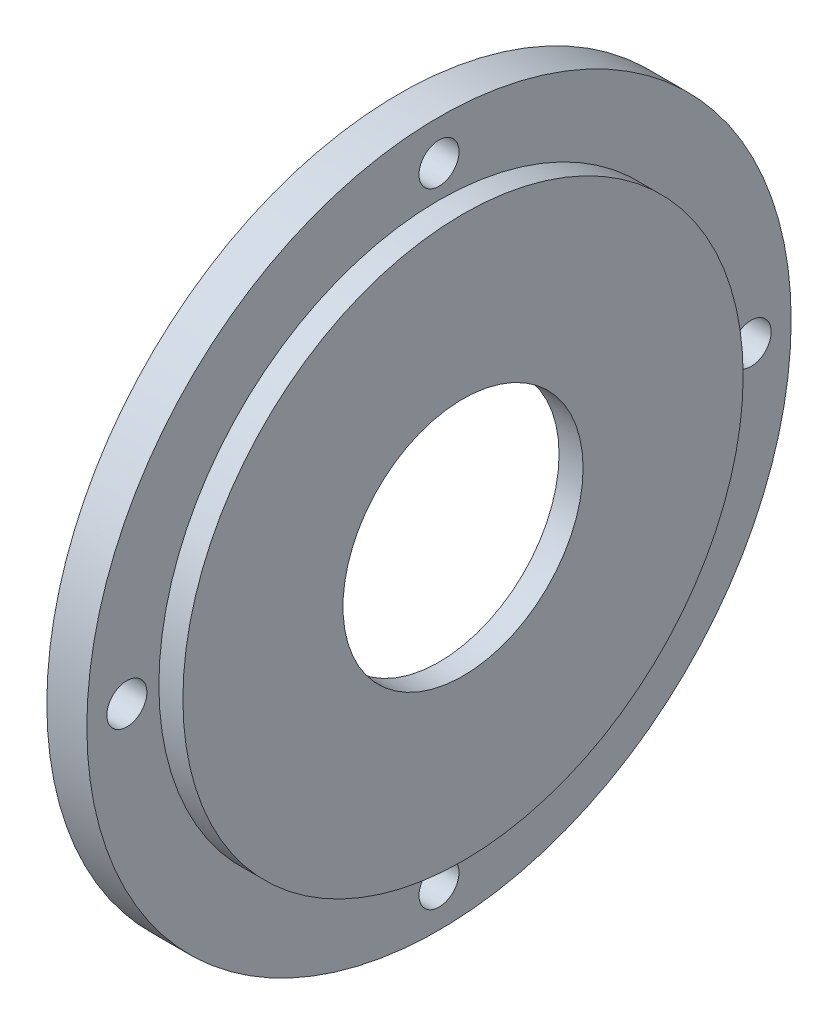
from build123d import *

# Parameters (mm, degrees)
SKETCH_1_R          = 44
SKETCH_1_R_2        = 27
EXTRUDE_1_DEPTH     = 5
SKETCH_2_R          = 35
EXTRUDE_2_DEPTH     = 3
SKETCH_3_R          = 2.5
CUT_EXTRUDE_1_DEPTH = 5
SKETCH_4_R          = 15
CUT_EXTRUDE_2_DEPTH = 8


with BuildPart() as part:
    # 草图1 → 凸台-拉伸1 (new body)
    with BuildSketch(Plane(origin=(0, 0, 0), x_dir=(0, 0, -1), z_dir=(1, 0, 0))):
        Circle(SKETCH_1_R)
        Circle(SKETCH_1_R_2, mode=Mode.SUBTRACT)
    extrude(amount=EXTRUDE_1_DEPTH)

    # 草图2 → 凸台-拉伸2 (add)
    with BuildSketch(Plane(origin=(5, 0, 0), x_dir=(0, 0, -1), z_dir=(1, 0, 0))):
        Circle(SKETCH_2_R)
    extrude(amount=EXTRUDE_2_DEPTH)

    # 草图3 → 切除-拉伸1 (cut)
    with BuildSketch(Plane(origin=(5, 0, 0), x_dir=(0, 0, -1), z_dir=(1, 0, 0))):
        with Locations((0, 39)):
            Circle(SKETCH_3_R)
        with Locations((39, 0)):
            Circle(SKETCH_3_R)
        with Locations((0, -39)):
            Circle(SKETCH_3_R)
        with Locations((-39, 0)):
            Circle(SKETCH_3_R)
    extrude(amount=-CUT_EXTRUDE_1_DEPTH, mode=Mode.SUBTRACT)

    # 草图4 → 切除-拉伸2 (cut)
    with BuildSketch(Plane(origin=(8, 0, 0), x_dir=(0, 0, -1), z_dir=(1, 0, 0))):
        Circle(SKETCH_4_R)
    extrude(amount=-CUT_EXTRUDE_2_DEPTH, mode=Mode.SUBTRACT)


solid = part.part
